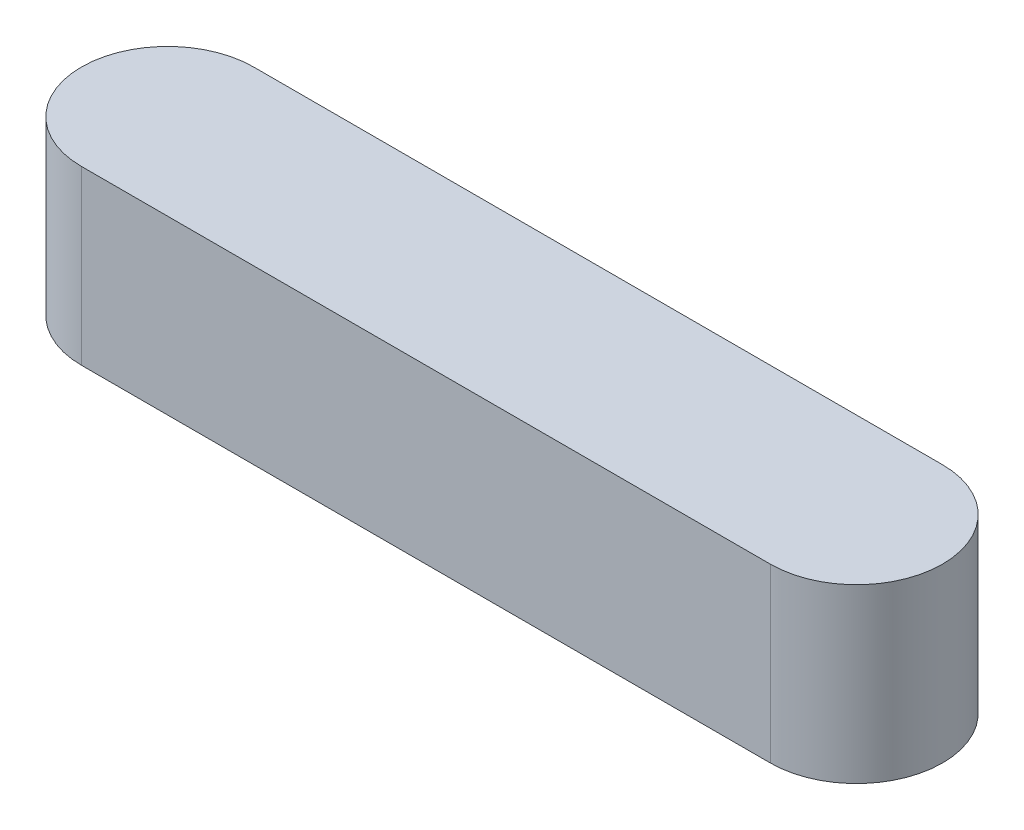
from build123d import *

# Parameters (mm, degrees)
EXTRUDE_1_DEPTH = 1


with BuildPart() as part:
    # 草图1 → 凸台-拉伸1 (new, symmetric)
    with BuildSketch(Plane(origin=(0, 0, 0), x_dir=(1, 0, 0), z_dir=(0, 1, 0))):
        with BuildLine():
            Line((-4, 1), (4, 1))
            ThreePointArc((4, 1), (5, 0), (4, -1))
            Line((4, -1), (-4, -1))
            ThreePointArc((-4, -1), (-5, 0), (-4, 1))
        make_face()
    extrude(amount=EXTRUDE_1_DEPTH, both=True)


solid = part.part
